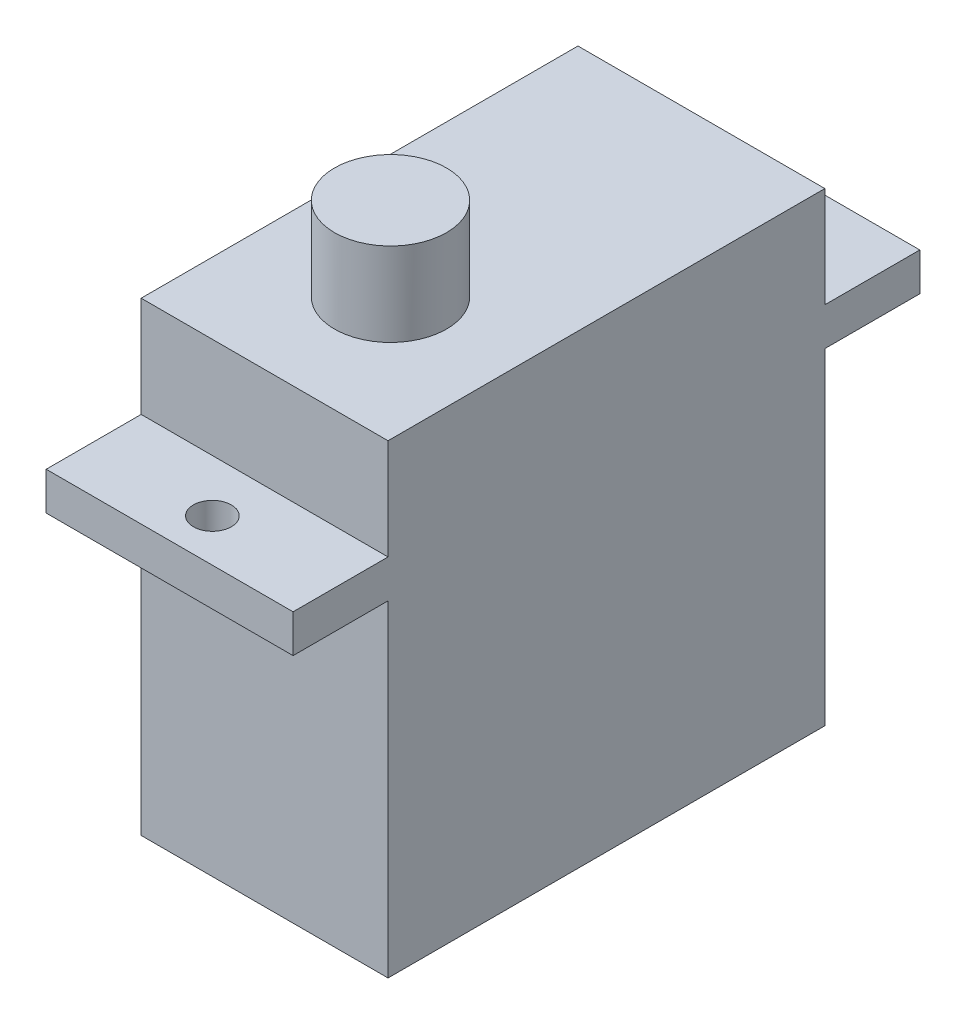
from build123d import *

# Parameters (mm, degrees)
EXTRUDE_1_DEPTH     = 13
SKETCH_4_R          = 1
CUT_EXTRUDE_1_DEPTH = 29.458566373
SKETCH_6_R          = 2.95
EXTRUDE_2_DEPTH     = 4.4


with BuildPart() as part:
    # 草圖1 → 填料-伸長1 (new body)
    with BuildSketch(Plane(origin=(0, 0, 0), x_dir=(0, 0, -1), z_dir=(1, 0, 0))):
        Polygon((11.5, 10.6), (16.5, 10.6), (16.5, 8.6), (11.5, 8.6), (11.5, -8.6), (-11.5, -8.6), (-11.5, 8.6), (-16.5, 8.6), (-16.5, 10.6), (-11.5, 10.6), (-11.5, 15.9), (11.5, 15.9), align=None)
    extrude(amount=EXTRUDE_1_DEPTH)

    # 草圖4 → 除料-伸長1 (cut, through all)
    with BuildSketch(Plane(origin=(0, 10.6, 0), x_dir=(1, 0, 0), z_dir=(0, 1, 0))):
        with Locations(Location((6.5, 14.25, 0), (0, 0, 270))):
            Circle(SKETCH_4_R)
        with Locations(Location((6.5, -14.25, 0), (0, 0, 270))):
            Circle(SKETCH_4_R)
    extrude(amount=-CUT_EXTRUDE_1_DEPTH, mode=Mode.SUBTRACT)

    # 草圖6 → 填料-伸長2 (add)
    with BuildSketch(Plane(origin=(0, 15.9, 0), x_dir=(1, 0, 0), z_dir=(0, 1, 0))):
        with Locations(Location((6.5, -4.87, 0), (0, 0, 90))):
            Circle(SKETCH_6_R)
    extrude(amount=EXTRUDE_2_DEPTH)


solid = part.part
